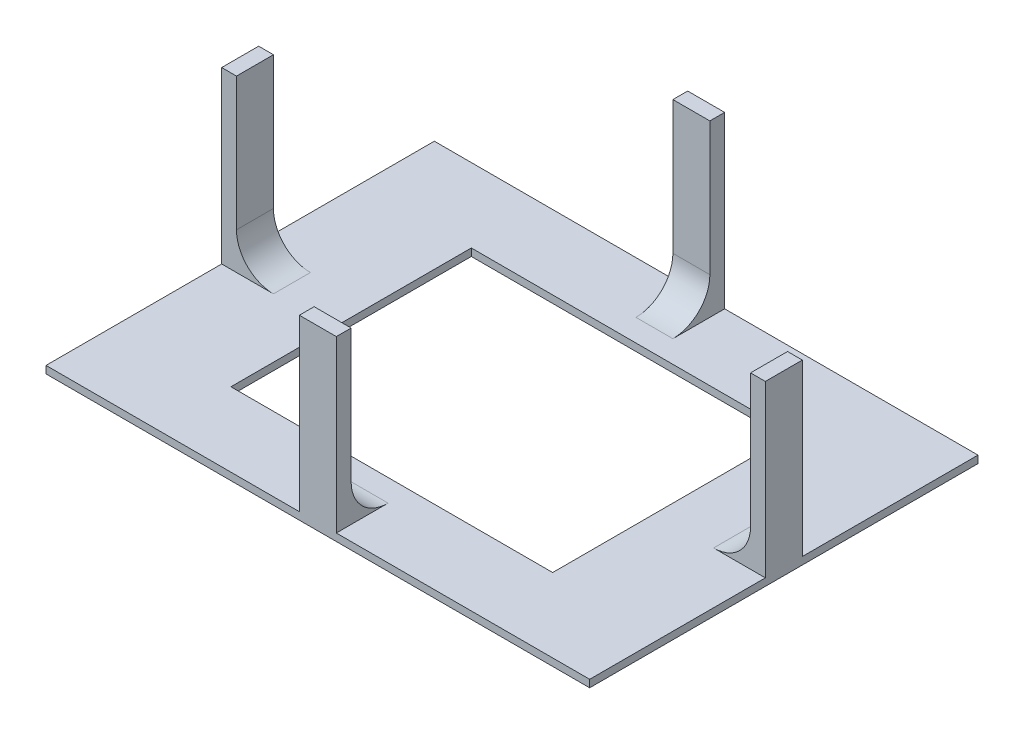
from build123d import *

# Parameters (mm, degrees)
CROQUIS1_W                 = 73.5
CROQUIS1_H                 = 52.5
SALIENTE_EXTRUIR1_DEPTH    = 24
CORTAR_EXTRUIR1_START      = 24
CROQUIS4_W                 = 69.5
CROQUIS4_H                 = 48.5
CORTAR_EXTRUIR1_DEPTH      = 23
CORTAR_EXTRUIR4_START      = 24
CROQUIS5_W                 = 34.25
CROQUIS5_H                 = 23.75
CORTAR_EXTRUIR4_DEPTH      = 23
REDONDEO2_R                = 5
REDONDEO3_R                = 5
REDONDEO4_R                = 5
REDONDEO5_R                = 5
CORTAR_EXTRUIR5_DEPTH      = 52.143181364
CORTAR_EXTRUIR5_DEPTH_BACK = 52.143181364
CROQUIS6_W                 = 43.5
CROQUIS6_H                 = 32.5


with BuildPart() as part:
    # Croquis1 → Saliente-Extruir1 (new body)
    with BuildSketch(Plane(origin=(0, 0, 0), x_dir=(1, 0, 0), z_dir=(0, 1, 0))):
        Rectangle(CROQUIS1_W, CROQUIS1_H)
    extrude(amount=SALIENTE_EXTRUIR1_DEPTH)

    # Croquis4 → Cortar-Extruir1 (cut)
    with BuildSketch(Plane(origin=(0, 0, 0), x_dir=(1, 0, 0), z_dir=(0, 1, 0)).offset(CORTAR_EXTRUIR1_START)):
        Rectangle(CROQUIS4_W, CROQUIS4_H)
    extrude(amount=-CORTAR_EXTRUIR1_DEPTH, mode=Mode.SUBTRACT)

    # Croquis5 → Cortar-Extruir4 (cut)
    with BuildSketch(Plane(origin=(0, 0, 0), x_dir=(1, 0, 0), z_dir=(0, 1, 0)).offset(CORTAR_EXTRUIR4_START)):
        with Locations((19.625, 14.375)):
            Rectangle(CROQUIS5_W, CROQUIS5_H)
        with Locations((-19.625, 14.375)):
            Rectangle(CROQUIS5_W, CROQUIS5_H)
        with Locations((-19.625, -14.375)):
            Rectangle(CROQUIS5_W, CROQUIS5_H)
        with Locations((19.625, -14.375)):
            Rectangle(CROQUIS5_W, CROQUIS5_H)
    extrude(amount=-CORTAR_EXTRUIR4_DEPTH, mode=Mode.SUBTRACT)

    # Redondeo2
    redondeo2_edges = [part.edges().sort_by_distance(p)[0] for p in [
        (0, 1, -24.25),
    ]]
    fillet(redondeo2_edges, radius=REDONDEO2_R)

    # Redondeo3
    redondeo3_edges = [part.edges().sort_by_distance(p)[0] for p in [
        (-34.75, 1, 0),
    ]]
    fillet(redondeo3_edges, radius=REDONDEO3_R)

    # Redondeo4
    redondeo4_edges = [part.edges().sort_by_distance(p)[0] for p in [
        (0, 1, 24.25),
    ]]
    fillet(redondeo4_edges, radius=REDONDEO4_R)

    # Redondeo5
    redondeo5_edges = [part.edges().sort_by_distance(p)[0] for p in [
        (34.75, 1, 0),
    ]]
    fillet(redondeo5_edges, radius=REDONDEO5_R)

    # Croquis6 → Cortar-Extruir5 (cut, two sides: drawn at the far end of the back side and taken through both)
    with BuildSketch(Plane(origin=(0, 0, 0), x_dir=(1, 0, 0), z_dir=(0, 1, 0)).offset(-CORTAR_EXTRUIR5_DEPTH_BACK)):
        Rectangle(CROQUIS6_W, CROQUIS6_H)
    extrude(amount=CORTAR_EXTRUIR5_DEPTH + CORTAR_EXTRUIR5_DEPTH_BACK, mode=Mode.SUBTRACT)


solid = part.part
